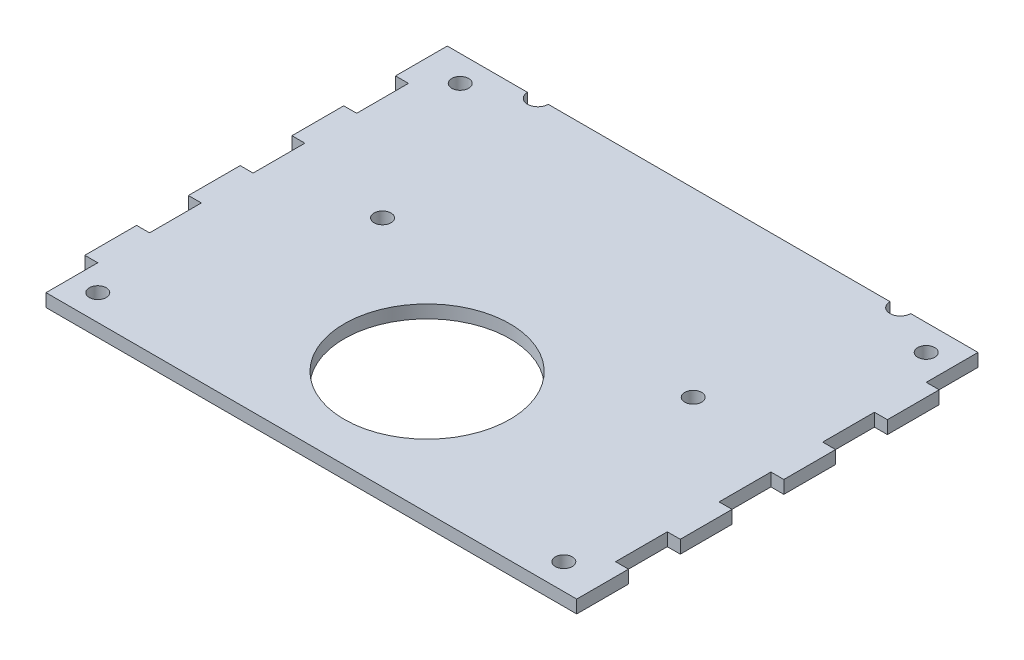
from build123d import *

# Parameters (mm, degrees)
SKETCH2_R           = 2.0828
SKETCH2_R_2         = 20.32
BOSS_EXTRUDE1_DEPTH = 3.175


with BuildPart() as part:
    # Sketch2 → Boss-Extrude1 (new body)
    with BuildSketch(Plane(origin=(0, 0, 0), x_dir=(1, 0, 0), z_dir=(0, 1, 0))):
        with BuildLine():
            Line((15.875, 0), (15.875, 12.7))
            Line((15.875, 12.7), (12.7, 12.7))
            Line((12.7, 12.7), (12.7, 25.4))
            Line((12.7, 25.4), (15.875, 25.4))
            Line((15.875, 25.4), (15.875, 38.1))
            Line((15.875, 38.1), (12.7, 38.1))
            Line((12.7, 38.1), (12.7, 50.8))
            Line((12.7, 50.8), (15.875, 50.8))
            Line((15.875, 50.8), (15.875, 63.5))
            Line((15.875, 63.5), (12.7, 63.5))
            Line((12.7, 63.5), (12.7, 76.2))
            Line((12.7, 76.2), (15.875, 76.2))
            Line((15.875, 76.2), (15.875, 88.9))
            Line((15.875, 88.9), (12.7, 88.9))
            Line((12.7, 88.9), (12.7, 101.6))
            Line((12.7, 101.6), (15.875, 101.6))
            Line((15.875, 101.6), (32.385, 101.6))
            ThreePointArc((32.385, 101.6), (34.925, 99.06), (37.465, 101.6))
            Line((37.465, 101.6), (121.285, 101.6))
            ThreePointArc((121.285, 101.6), (123.825, 99.06), (126.365, 101.6))
            Line((126.365, 101.6), (142.875, 101.6))
            Line((142.875, 101.6), (142.875, 88.9))
            Line((142.875, 88.9), (146.05, 88.9))
            Line((146.05, 88.9), (146.05, 76.2))
            Line((146.05, 76.2), (142.875, 76.2))
            Line((142.875, 76.2), (142.875, 63.5))
            Line((142.875, 63.5), (146.05, 63.5))
            Line((146.05, 63.5), (146.05, 50.8))
            Line((146.05, 50.8), (142.875, 50.8))
            Line((142.875, 50.8), (142.875, 38.1))
            Line((142.875, 38.1), (146.05, 38.1))
            Line((146.05, 38.1), (146.05, 25.4))
            Line((146.05, 25.4), (142.875, 25.4))
            Line((142.875, 25.4), (142.875, 12.7))
            Line((142.875, 12.7), (146.05, 12.7))
            Line((146.05, 12.7), (146.05, 0))
            Line((146.05, 0), (15.875, 0))
        make_face()
        with Locations(Location((41.275, 57.15, 0), (0, 0, 270))):
            Circle(SKETCH2_R, mode=Mode.SUBTRACT)
        with Locations(Location((136.525, 6.35, 0), (0, 0, 90))):
            Circle(SKETCH2_R, mode=Mode.SUBTRACT)
        with Locations(Location((79.375, 29.972, 0), (0, 0, 270))):
            Circle(SKETCH2_R_2, mode=Mode.SUBTRACT)
        with Locations(Location((22.225, 6.35, 0), (0, 0, 270))):
            Circle(SKETCH2_R, mode=Mode.SUBTRACT)
        with Locations(Location((117.475, 57.15, 0), (0, 0, 90))):
            Circle(SKETCH2_R, mode=Mode.SUBTRACT)
        with Locations(Location((22.225, 95.25, 0), (0, 0, 90))):
            Circle(SKETCH2_R, mode=Mode.SUBTRACT)
        with Locations(Location((136.525, 95.25, 0), (0, 0, 270))):
            Circle(SKETCH2_R, mode=Mode.SUBTRACT)
    extrude(amount=BOSS_EXTRUDE1_DEPTH)


solid = part.part
